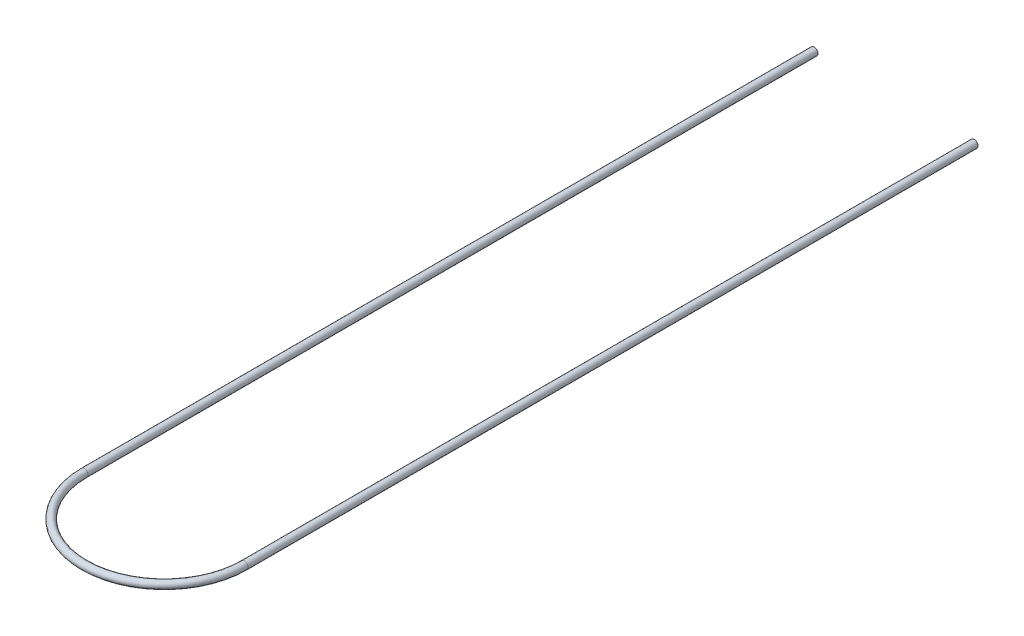
from build123d import *

# Parameters (mm, degrees)
SKETCH2_R   = 11.1
SKETCH2_R_2 = 9.95


with BuildPart() as part:
    # Sweep1: sweep along a path in Sketch1
    with BuildLine(Plane(origin=(0, 0, 0), x_dir=(1, 0, 0), z_dir=(0, 1, 0))) as sweep1_path:
        Line((429.23, -300), (429.23, -2440))
        ThreePointArc((429.23, -2440), (194.615, -2674.615), (-40, -2440))
        Line((-40, -2440), (-40, -300))
    # Sketch2 → Sweep1 (sweep)
    with BuildSketch(Plane(origin=(429.23, 0, 300), x_dir=(-1, 0, 0), z_dir=(0, 0, -1))):
        Circle(SKETCH2_R)
        Circle(SKETCH2_R_2, mode=Mode.SUBTRACT)
    sweep(path=sweep1_path.line)


solid = part.part
